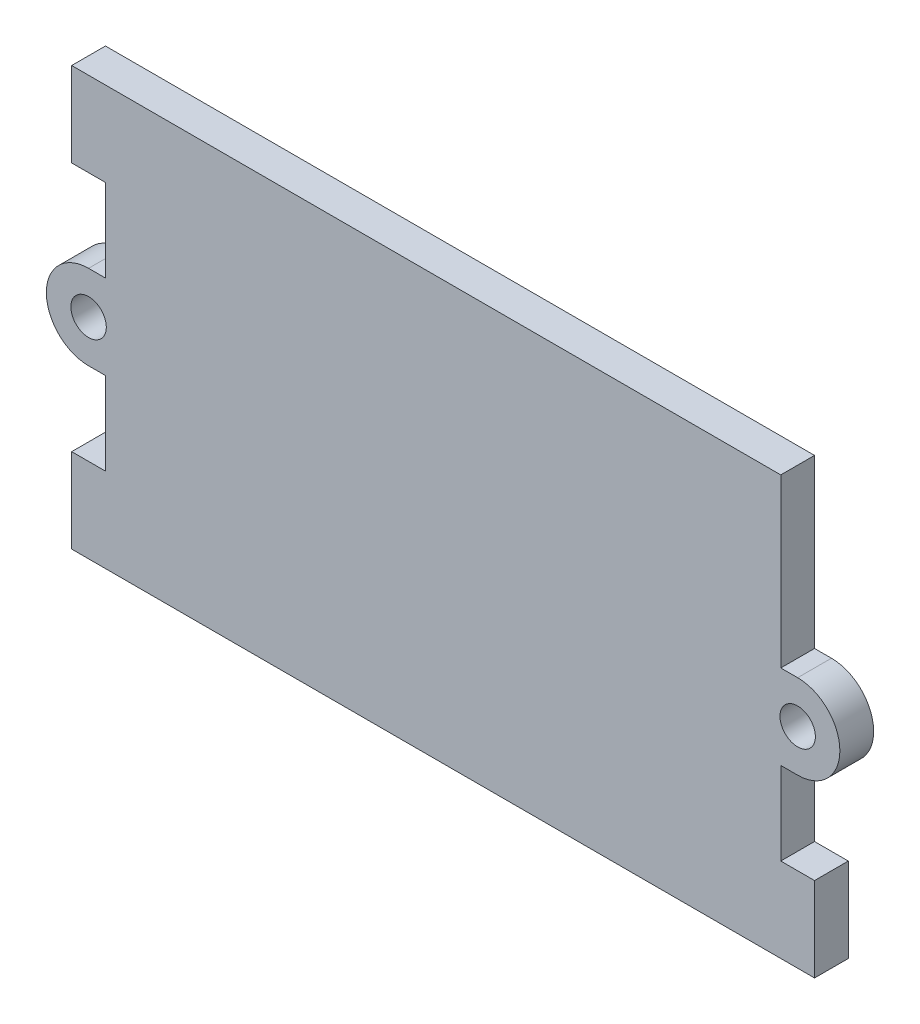
from build123d import *

# Parameters (mm, degrees)
ESQUISSE1_W             = 80
ESQUISSE1_H             = 49.614813968
BOSS_EXTRU_1_DEPTH      = 4
ESQUISSE3_W             = 4
ESQUISSE3_H             = 10
BOSS_EXTRU_3_DEPTH      = 4
ESQUISSE4_R             = 2.1
ENL_V_MAT_EXTRU_1_DEPTH = 101.232877665


with BuildPart() as part:
    # Esquisse1 → Boss.-Extru.1 (new body)
    with BuildSketch(Plane.XY):
        with Locations((40, 24.807406984)):
            Rectangle(ESQUISSE1_W, ESQUISSE1_H)
    extrude(amount=BOSS_EXTRU_1_DEPTH)

    # Esquisse3 → Boss.-Extru.3 (add)
    with BuildSketch(Plane(origin=(0, 0, 4), x_dir=(-1, 0, 0), z_dir=(0, 0, -1))):
        with Locations((2, 5)):
            Rectangle(ESQUISSE3_W, ESQUISSE3_H)
        with BuildLine():
            Line((0, 19.807406984), (2, 19.807406984))
            ThreePointArc((2, 19.807406984), (7, 24.807406984), (2, 29.807406984))
            Line((2, 29.807406984), (0, 29.807406984))
            Line((0, 29.807406984), (0, 19.807406984))
        make_face()
        with Locations((2, 44.614813968)):
            Rectangle(ESQUISSE3_W, ESQUISSE3_H)
        with BuildLine():
            Line((-80, 29.807406984), (-82, 29.807406984))
            ThreePointArc((-82, 29.807406984), (-87, 24.807406984), (-82, 19.807406984))
            Line((-82, 19.807406984), (-80, 19.807406984))
            Line((-80, 19.807406984), (-80, 29.807406984))
        make_face()
        with Locations((-82, 5)):
            Rectangle(ESQUISSE3_W, ESQUISSE3_H)
    extrude(amount=BOSS_EXTRU_3_DEPTH)

    # Esquisse4 → Enlèv. mat.-Extru.1 (cut, through all)
    with BuildSketch(Plane(origin=(0, 0, 0), x_dir=(-1, 0, 0), z_dir=(0, 0, -1))):
        with Locations((2, 24.807406984)):
            Circle(ESQUISSE4_R)
        with Locations((-82, 24.807406984)):
            Circle(ESQUISSE4_R)
    extrude(amount=-ENL_V_MAT_EXTRU_1_DEPTH, mode=Mode.SUBTRACT)


solid = part.part
